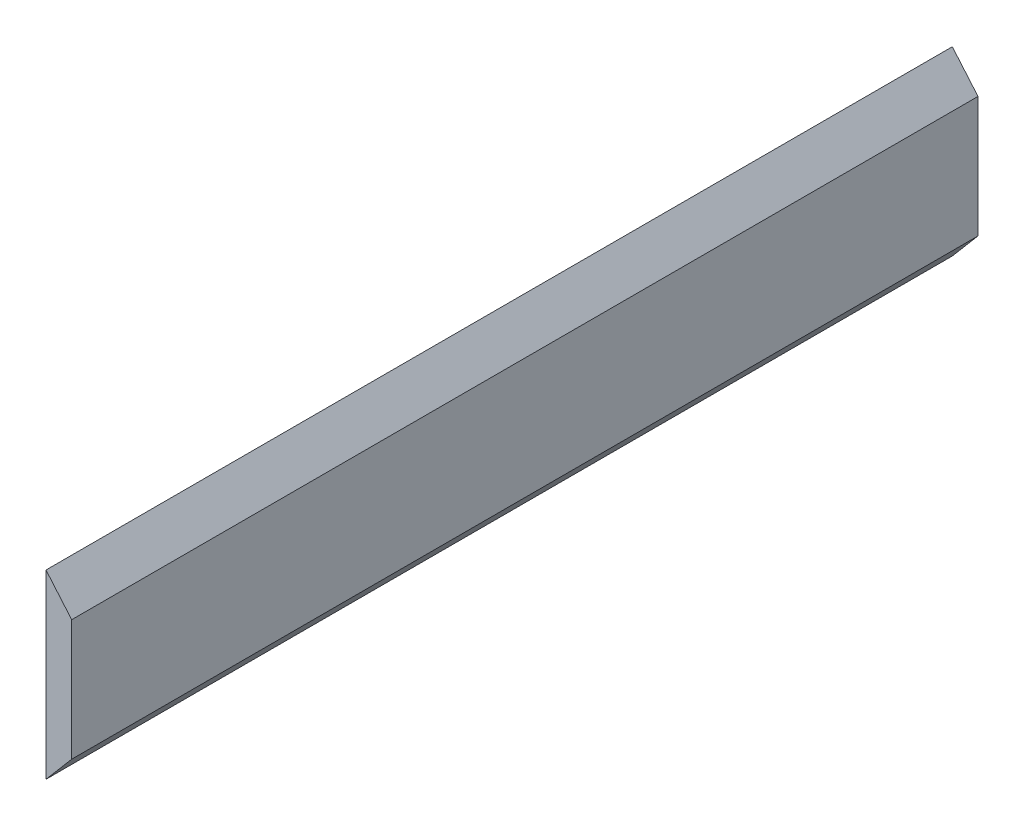
from build123d import *

# Parameters (mm, degrees)
BOSS_EXTRUDE1_DEPTH = 600


with BuildPart() as part:
    # Sketch2 → Boss-Extrude1 (new body)
    with BuildSketch(Plane.XY):
        Polygon((-148, 65), (-148, 185), (-131, 165), (-131, 85), align=None)
    extrude(amount=BOSS_EXTRUDE1_DEPTH)


solid = part.part
